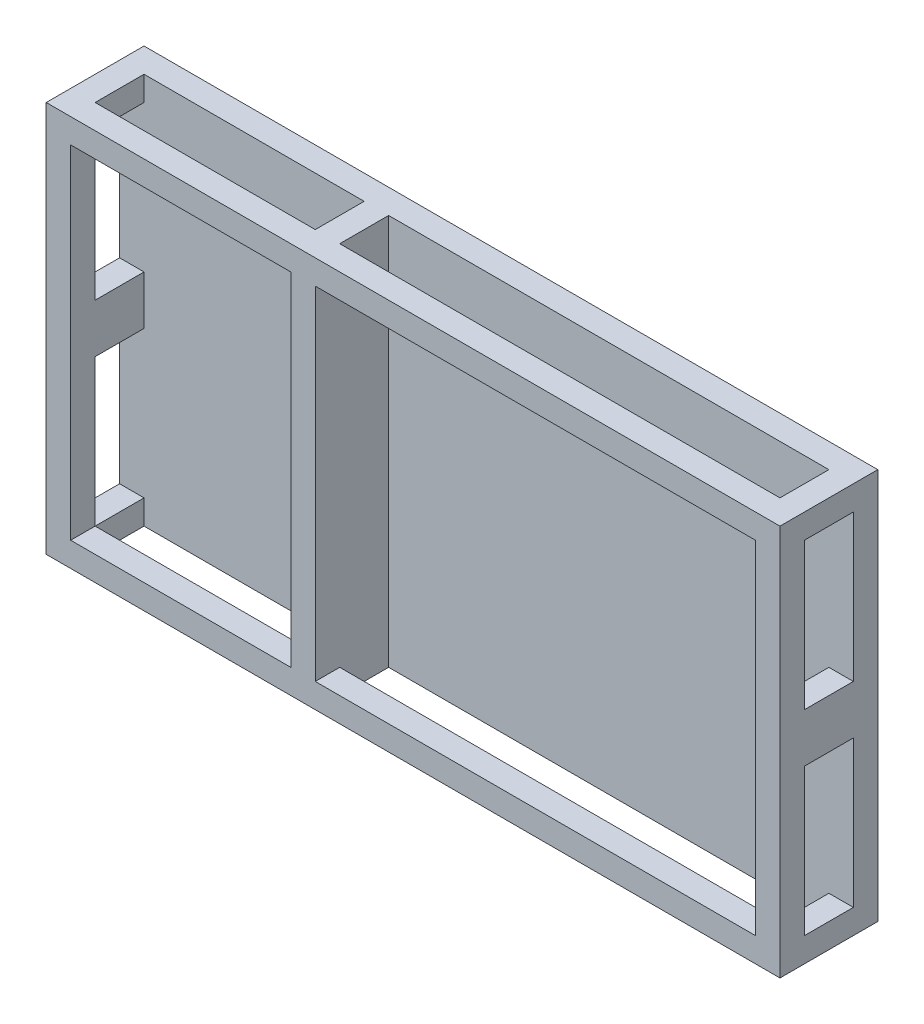
from build123d import *

# Parameters (mm, degrees)
ESBO_O1_W                = 150
ESBO_O1_H                = 80
RESSALTO_EXTRUS_O1_DEPTH = 20
ESBO_O2_W                = 140
ESBO_O2_H                = 10
CORTE_EXTRUS_O1_DEPTH    = 172.172427686
ESBO_O3_W                = 10
ESBO_O3_H                = 70
CORTE_EXTRUS_O2_DEPTH    = 172.172427686
ESBO_O4_W                = 45
ESBO_O4_H                = 70
ESBO_O4_W_2              = 90
CORTE_EXTRUS_O3_DEPTH    = 15
ESBO_O5_W                = 5.002119461
ESBO_O5_H                = 20
RESSALTO_EXTRUS_O2_DEPTH = 80
ESBO_O6_W                = 20
ESBO_O6_H                = 10
RESSALTO_EXTRUS_O3_DEPTH = 5
ESBO_O7_W                = 20
ESBO_O7_H                = 10
RESSALTO_EXTRUS_O4_DEPTH = 5


with BuildPart() as part:
    # Esboço1 → Ressalto-extrusão1 (new body)
    with BuildSketch(Plane.XY):
        with Locations((75, 40)):
            Rectangle(ESBO_O1_W, ESBO_O1_H)
    extrude(amount=RESSALTO_EXTRUS_O1_DEPTH)

    # Esboço2 → Corte-extrusão1 (cut, through all)
    with BuildSketch(Plane(origin=(0, 80, 0), x_dir=(1, 0, 0), z_dir=(0, 1, 0))):
        with Locations((75, -10)):
            Rectangle(ESBO_O2_W, ESBO_O2_H)
    extrude(amount=-CORTE_EXTRUS_O1_DEPTH, mode=Mode.SUBTRACT)

    # Esboço3 → Corte-extrusão2 (cut, through all)
    with BuildSketch(Plane.ZY):
        with Locations((10, 40)):
            Rectangle(ESBO_O3_W, ESBO_O3_H)
    extrude(amount=-CORTE_EXTRUS_O2_DEPTH, mode=Mode.SUBTRACT)

    # Esboço4 → Corte-extrusão3 (cut)
    with BuildSketch(Plane.XY.offset(20)):
        with Locations((27.5, 40)):
            Rectangle(ESBO_O4_W, ESBO_O4_H)
        with Locations((100, 40)):
            Rectangle(ESBO_O4_W_2, ESBO_O4_H)
    extrude(amount=-CORTE_EXTRUS_O3_DEPTH, mode=Mode.SUBTRACT)

    # Esboço5 → Ressalto-extrusão2 (add)
    with BuildSketch(Plane(origin=(0, 80, 0), x_dir=(1, 0, 0), z_dir=(0, 1, 0))):
        with Locations((52.501059731, -10)):
            Rectangle(ESBO_O5_W, ESBO_O5_H)
    extrude(amount=-RESSALTO_EXTRUS_O2_DEPTH)

    # Esboço6 → Ressalto-extrusão3 (add)
    with BuildSketch(Plane.ZY):
        with Locations((10, 40)):
            Rectangle(ESBO_O6_W, ESBO_O6_H)
    extrude(amount=-RESSALTO_EXTRUS_O3_DEPTH)

    # Esboço7 → Ressalto-extrusão4 (add)
    with BuildSketch(Plane(origin=(150, 0, 0), x_dir=(0, 0, -1), z_dir=(1, 0, 0))):
        with Locations((-10, 40)):
            Rectangle(ESBO_O7_W, ESBO_O7_H)
    extrude(amount=-RESSALTO_EXTRUS_O4_DEPTH)


solid = part.part
